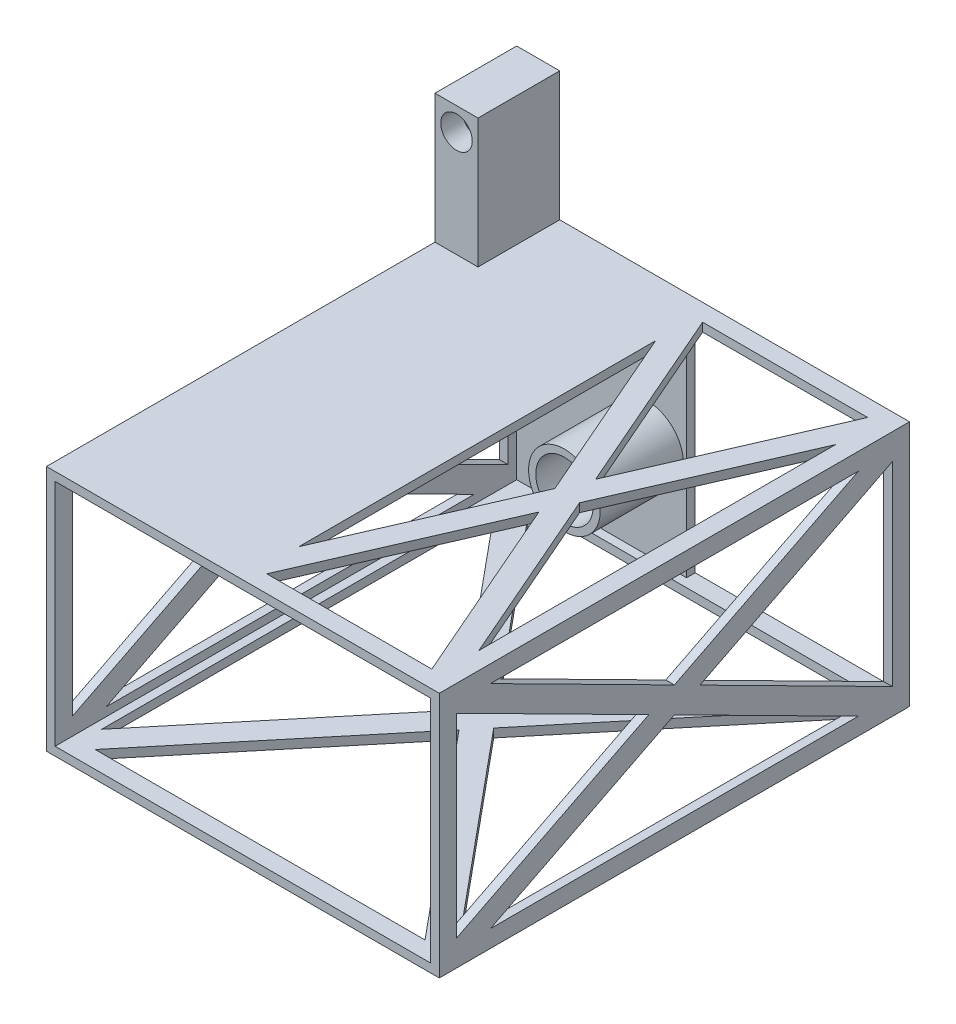
from build123d import *

# Parameters (mm, degrees)
SKETCH1_W            = 137
SKETCH1_H            = 86
SKETCH1_W_2          = 131
SKETCH1_H_2          = 80
BOSS_EXTRUDE1_DEPTH  = 164
SKETCH2_W            = 125
SKETCH2_H            = 152
CUT_EXTRUDE1_DEPTH   = 3
BOSS_EXTRUDE2_DEPTH  = 3
BOSS_EXTRUDE3_DEPTH  = 3
SKETCH3_W            = 152
SKETCH3_H            = 74
CUT_EXTRUDE2_DEPTH   = 3
BOSS_EXTRUDE4_DEPTH  = 3
BOSS_EXTRUDE5_DEPTH  = 3
SKETCH4_W            = 152
SKETCH4_H            = 74
CUT_EXTRUDE3_DEPTH   = 3
BOSS_EXTRUDE6_DEPTH  = 3
BOSS_EXTRUDE7_DEPTH  = 3
SKETCH6_W            = 62.23
SKETCH6_H            = 86
BOSS_EXTRUDE8_DEPTH  = 3
SKETCH7_W            = 62.77
SKETCH7_H            = 152
CUT_EXTRUDE4_DEPTH   = 3
BOSS_EXTRUDE9_DEPTH  = 3
BOSS_EXTRUDE10_DEPTH = 3
SKETCH8_R            = 12.5
SKETCH8_R_2          = 10
BOSS_EXTRUDE11_DEPTH = 32
SKETCH8_4_R          = 10
CUT_EXTRUDE8_DEPTH   = 32
SKETCH9_W            = 6
SKETCH9_H            = 15
BOSS_EXTRUDE12_DEPTH = 15
SKETCH9_3_W          = 6
SKETCH9_3_H          = 15
BOSS_EXTRUDE13_DEPTH = 12
SKETCH9_4_W          = 6
SKETCH9_4_H          = 15
BOSS_EXTRUDE14_DEPTH = 15
FILLET1_R            = 3
SKETCH9_5_W          = 6
SKETCH9_5_H          = 28.664942424
BOSS_EXTRUDE17_DEPTH = 3
SKETCH16_R           = 2
CUT_EXTRUDE13_DEPTH  = 64
SKETCH11_W           = 15
SKETCH11_H           = 10
BOSS_EXTRUDE18_DEPTH = 45
SKETCH18_R           = 1
CUT_EXTRUDE14_DEPTH  = 10
SKETCH19_W           = 15
SKETCH19_H           = 45
BOSS_EXTRUDE19_DEPTH = 2
SKETCH20_R           = 1.65
CUT_EXTRUDE15_DEPTH  = 2
SKETCH21_W           = 15
SKETCH21_H           = 45
BOSS_EXTRUDE20_DEPTH = 9
SKETCH21_3_R         = 3.25
CUT_EXTRUDE16_DEPTH  = 9
SKETCH25_W           = 15
SKETCH25_H           = 45
SKETCH25_R           = 5.5
BOSS_EXTRUDE21_DEPTH = 7.5


with BuildPart() as part:
    # Sketch1 → Boss-Extrude1 (new body)
    with BuildSketch(Plane.XY):
        with Locations((68.5, -43)):
            Rectangle(SKETCH1_W, SKETCH1_H)
        with Locations((68.5, -43)):
            Rectangle(SKETCH1_W_2, SKETCH1_H_2, mode=Mode.SUBTRACT)
    extrude(amount=BOSS_EXTRUDE1_DEPTH)

    # Sketch2 → Cut-Extrude1 (cut)
    with BuildSketch(Plane.XZ.offset(86)):
        with Locations((68.5, 82)):
            Rectangle(SKETCH2_W, SKETCH2_H)
    extrude(amount=-CUT_EXTRUDE1_DEPTH, mode=Mode.SUBTRACT)

    # Sketch2<3> → Boss-Extrude2 (add)
    with BuildSketch(Plane.XZ.offset(86)):
        Polygon((0, 158), (131, 0), (137, 6), (6, 164), align=None)
    extrude(amount=-BOSS_EXTRUDE2_DEPTH)

    # Sketch2<4> → Boss-Extrude3 (add)
    with BuildSketch(Plane.XZ.offset(86)):
        Polygon((131, 164), (0, 6), (6, 0), (137, 158), align=None)
    extrude(amount=-BOSS_EXTRUDE3_DEPTH)

    # Sketch3 → Cut-Extrude2 (cut)
    with BuildSketch(Plane(origin=(137, 0, 0), x_dir=(0, 0, -1), z_dir=(1, 0, 0))):
        with Locations((-82, -43)):
            Rectangle(SKETCH3_W, SKETCH3_H)
    extrude(amount=-CUT_EXTRUDE2_DEPTH, mode=Mode.SUBTRACT)

    # Sketch3<3> → Boss-Extrude4 (add)
    with BuildSketch(Plane(origin=(137, 0, 0), x_dir=(0, 0, -1), z_dir=(1, 0, 0))):
        Polygon((-164, -6), (-6, -86), (0, -80), (-158, 0), align=None)
    extrude(amount=-BOSS_EXTRUDE4_DEPTH)

    # Sketch3<5> → Boss-Extrude5 (add)
    with BuildSketch(Plane(origin=(137, 0, 0), x_dir=(0, 0, -1), z_dir=(1, 0, 0))):
        Polygon((-158, -86), (0, -6), (-6, 0), (-164, -80), align=None)
    extrude(amount=-BOSS_EXTRUDE5_DEPTH)

    # Sketch4 → Cut-Extrude3 (cut)
    with BuildSketch(Plane.ZY):
        with Locations((82, -43)):
            Rectangle(SKETCH4_W, SKETCH4_H)
    extrude(amount=-CUT_EXTRUDE3_DEPTH, mode=Mode.SUBTRACT)

    # Sketch4<4> → Boss-Extrude6 (add)
    with BuildSketch(Plane.ZY):
        Polygon((158, 0), (0, -80), (6, -86), (164, -6), align=None)
    extrude(amount=-BOSS_EXTRUDE6_DEPTH)

    # Sketch4<5> → Boss-Extrude7 (add)
    with BuildSketch(Plane.ZY):
        Polygon((6, 0), (164, -80), (158, -86), (0, -6), align=None)
    extrude(amount=-BOSS_EXTRUDE7_DEPTH)

    # Sketch6 → Boss-Extrude8 (add)
    with BuildSketch(Plane(origin=(0, 0, 0), x_dir=(-1, 0, 0), z_dir=(0, 0, -1))):
        with Locations((-31.115, -43)):
            Rectangle(SKETCH6_W, SKETCH6_H)
    extrude(amount=-BOSS_EXTRUDE8_DEPTH)

    # Sketch7 → Cut-Extrude4 (cut)
    with BuildSketch(Plane(origin=(0, 0, 0), x_dir=(1, 0, 0), z_dir=(0, 1, 0))):
        with Locations((99.615, -82)):
            Rectangle(SKETCH7_W, SKETCH7_H)
    extrude(amount=-CUT_EXTRUDE4_DEPTH, mode=Mode.SUBTRACT)

    # Sketch7<3> → Boss-Extrude9 (add)
    with BuildSketch(Plane(origin=(0, 0, 0), x_dir=(1, 0, 0), z_dir=(0, 1, 0))):
        Polygon((68.23, 0), (137, -158), (131, -164), (62.23, -6), align=None)
    extrude(amount=-BOSS_EXTRUDE9_DEPTH)

    # Sketch7<4> → Boss-Extrude10 (add)
    with BuildSketch(Plane(origin=(0, 0, 0), x_dir=(1, 0, 0), z_dir=(0, 1, 0))):
        Polygon((131, 0), (62.23, -158), (68.23, -164), (137, -6), align=None)
    extrude(amount=-BOSS_EXTRUDE10_DEPTH)

    # Sketch8 → Boss-Extrude11 (add)
    with BuildSketch(Plane(origin=(0, 0, 0), x_dir=(-1, 0, 0), z_dir=(0, 0, -1))):
        with Locations((-48.64, -48.9)):
            Circle(SKETCH8_R)
        with Locations((-48.64, -48.9)):
            Circle(SKETCH8_R_2, mode=Mode.SUBTRACT)
    extrude(amount=-BOSS_EXTRUDE11_DEPTH)

    # Sketch8<4> → Cut-Extrude8 (cut)
    with BuildSketch(Plane(origin=(0, 0, 0), x_dir=(-1, 0, 0), z_dir=(0, 0, -1))):
        with Locations((-48.64, -48.9)):
            Circle(SKETCH8_4_R)
    extrude(amount=-CUT_EXTRUDE8_DEPTH, mode=Mode.SUBTRACT)

    # Sketch9 → Boss-Extrude12 (add)
    with BuildSketch(Plane.ZY):
        with Locations((55, -48.9)):
            Rectangle(SKETCH9_W, SKETCH9_H)
    extrude(amount=BOSS_EXTRUDE12_DEPTH)

    # Sketch9<3> → Boss-Extrude13 (add)
    with BuildSketch(Plane.ZY):
        with Locations((55, -48.9)):
            Rectangle(SKETCH9_3_W, SKETCH9_3_H)
    extrude(amount=BOSS_EXTRUDE13_DEPTH)

    # Sketch9<4> → Boss-Extrude14 (add)
    with BuildSketch(Plane.ZY):
        with Locations((3, -48.9)):
            Rectangle(SKETCH9_4_W, SKETCH9_4_H)
    extrude(amount=BOSS_EXTRUDE14_DEPTH)

    # Fillet1
    fillet1_edges = [part.edges().sort_by_distance(p)[0] for p in [
        (-15, -41.4, 3),
        (-15, -56.4, 3),
        (-15, -41.4, 55),
        (-15, -56.4, 55),
    ]]
    fillet(fillet1_edges, radius=FILLET1_R)

    # Sketch9<5> → Boss-Extrude17 (add)
    with BuildSketch(Plane.ZY):
        with Locations((55, -42.711986128)):
            Rectangle(SKETCH9_5_W, SKETCH9_5_H)
    extrude(amount=-BOSS_EXTRUDE17_DEPTH)

    # Sketch16 → Cut-Extrude13 (cut)
    with BuildSketch(Plane.XY.offset(58)):
        with Locations((-7.5, -48.9)):
            Circle(SKETCH16_R)
    extrude(amount=-CUT_EXTRUDE13_DEPTH, mode=Mode.SUBTRACT)

    # Sketch11 → Boss-Extrude18 (add)
    with BuildSketch(Plane(origin=(0, 0, 0), x_dir=(1, 0, 0), z_dir=(0, 1, 0))):
        with Locations((7.5, -5)):
            Rectangle(SKETCH11_W, SKETCH11_H)
    extrude(amount=BOSS_EXTRUDE18_DEPTH)

    # Sketch18 → Cut-Extrude14 (cut)
    with BuildSketch(Plane.XY.offset(10)):
        with Locations((7.5, 37)):
            Circle(SKETCH18_R)
    extrude(amount=-CUT_EXTRUDE14_DEPTH, mode=Mode.SUBTRACT)

    # Sketch19 → Boss-Extrude19 (add)
    with BuildSketch(Plane.XY.offset(10)):
        with Locations((7.5, 22.5)):
            Rectangle(SKETCH19_W, SKETCH19_H)
    extrude(amount=BOSS_EXTRUDE19_DEPTH)

    # Sketch20 → Cut-Extrude15 (cut)
    with BuildSketch(Plane.XY.offset(12)):
        with Locations((7.5, 37)):
            Circle(SKETCH20_R)
    extrude(amount=-CUT_EXTRUDE15_DEPTH, mode=Mode.SUBTRACT)

    # Sketch21 → Boss-Extrude20 (add)
    with BuildSketch(Plane.XY.offset(12)):
        with Locations((7.5, 22.5)):
            Rectangle(SKETCH21_W, SKETCH21_H)
    extrude(amount=BOSS_EXTRUDE20_DEPTH)

    # Sketch21<3> → Cut-Extrude16 (cut)
    with BuildSketch(Plane.XY.offset(12)):
        with Locations((7.5, 37)):
            Circle(SKETCH21_3_R)
    extrude(amount=CUT_EXTRUDE16_DEPTH, mode=Mode.SUBTRACT)

    # Sketch25 → Boss-Extrude21 (add)
    with BuildSketch(Plane.XY.offset(21)):
        with Locations((7.5, 22.5)):
            Rectangle(SKETCH25_W, SKETCH25_H)
        with Locations((7.5, 37)):
            Circle(SKETCH25_R, mode=Mode.SUBTRACT)
    extrude(amount=BOSS_EXTRUDE21_DEPTH)


solid = part.part
